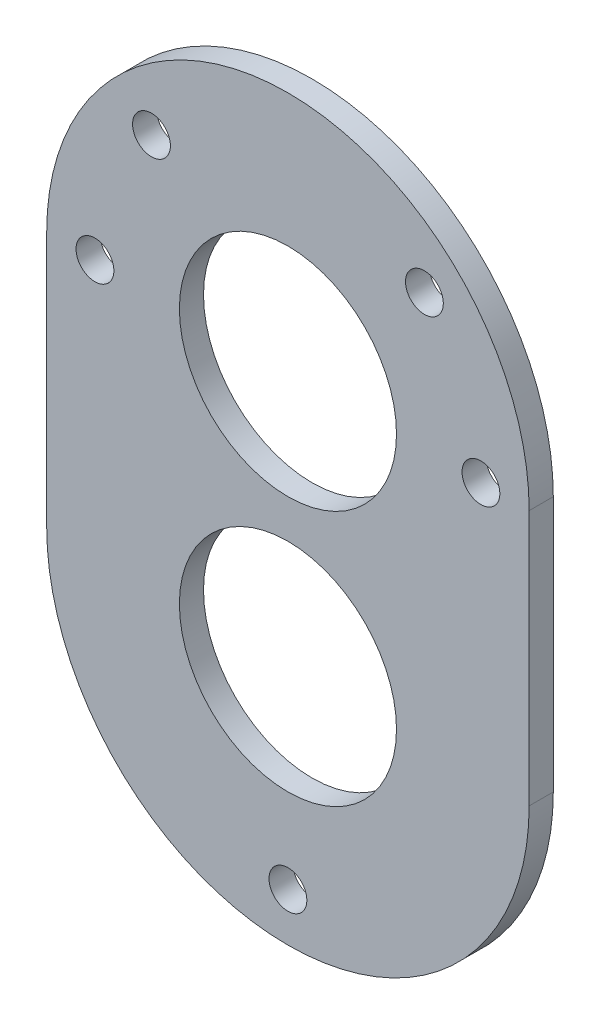
from build123d import *

# Parameters (mm, degrees)
SKETCH1_R                  = 14.2875
BOSS_EXTRUDE1_DEPTH        = 3.175
F_9_0_196_DIAMETER_HOLE1_D = 4.9784


with BuildPart() as part:
    # Sketch1 → Boss-Extrude1 (new body)
    with BuildSketch(Plane(origin=(0, 0, 0), x_dir=(0, 1, 0), z_dir=(0, 0, 1))):
        with BuildLine():
            Line((-33.655, 31.75), (0, 31.75))
            ThreePointArc((0, 31.75), (31.75, 0), (0, -31.75))
            Line((0, -31.75), (-33.655, -31.75))
            ThreePointArc((-33.655, -31.75), (-65.405, 0), (-33.655, 31.75))
        make_face()
        with Locations(Location((0, 0, 0), (0, 0, 270))):
            Circle(SKETCH1_R, mode=Mode.SUBTRACT)
        with Locations(Location((-33.655, 0, 0), (0, 0, 270))):
            Circle(SKETCH1_R, mode=Mode.SUBTRACT)
    extrude(amount=BOSS_EXTRUDE1_DEPTH)

    # #9 (0.196) Diameter Hole1 (through all)
    with Locations(Plane.XY.offset(3.175)):
        with Locations((-58.38589225, 11.773697217), (-25.4, 0), (25.4, 0), (0, -59.055), (-17.960512242, 17.960512242), (17.960512242, 17.960512242)):
            Hole(F_9_0_196_DIAMETER_HOLE1_D / 2)


solid = part.part
